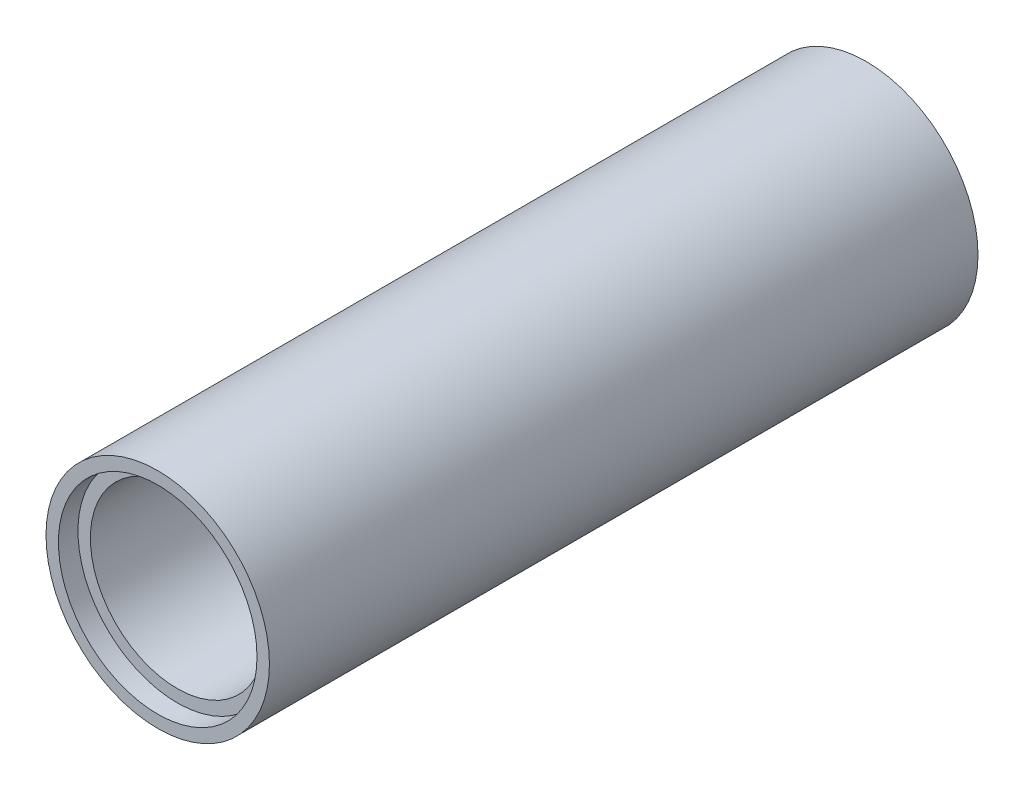
from build123d import *

# Parameters (mm, degrees)
SZKIC1_R                    = 57.15
SZKIC1_R_2                  = 44.45
DODANIE_WYCI_GNI_CIE1_DEPTH = 362.5
WYTNIJ_WYCI_GNI_CIE1_START  = -10
SZKIC2_R                    = 50.8
SZKIC2_R_2                  = 44.45
WYTNIJ_WYCI_GNI_CIE1_DEPTH  = 10


with BuildPart() as part:
    # Szkic1 → Dodanie-wyciągnięcie1 (new body)
    with BuildSketch(Plane.XY):
        Circle(SZKIC1_R)
        Circle(SZKIC1_R_2, mode=Mode.SUBTRACT)
    extrude(amount=DODANIE_WYCI_GNI_CIE1_DEPTH)

    # Szkic2 → Wytnij-wyciągnięcie1 (cut)
    with BuildSketch(Plane.XY.offset(362.5).offset(WYTNIJ_WYCI_GNI_CIE1_START)):
        Circle(SZKIC2_R)
        Circle(SZKIC2_R_2, mode=Mode.SUBTRACT)
    extrude(amount=WYTNIJ_WYCI_GNI_CIE1_DEPTH, mode=Mode.SUBTRACT)


solid = part.part
